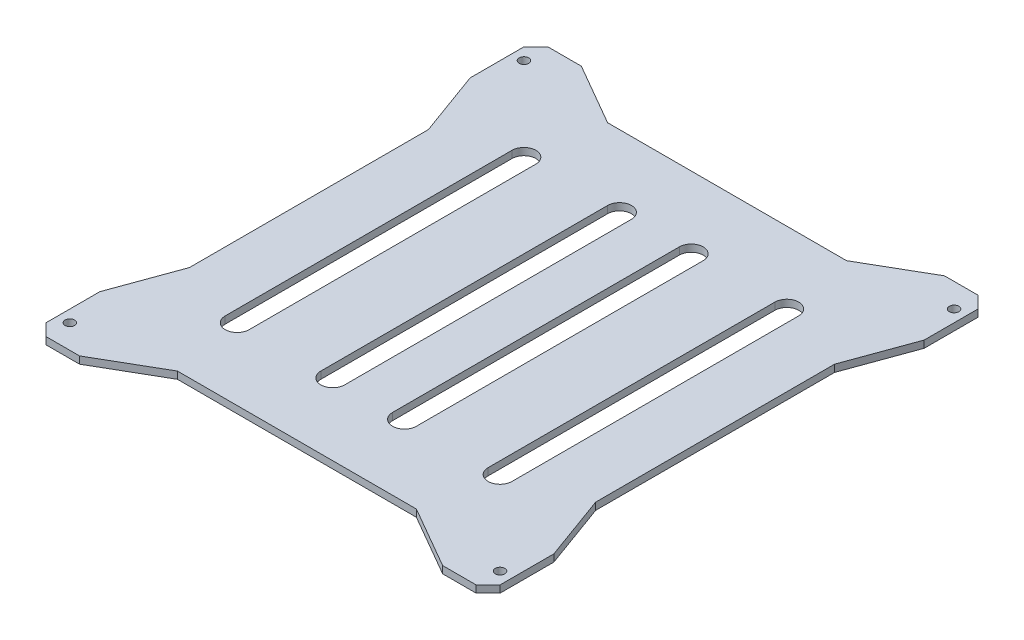
from build123d import *

# Parameters (mm, degrees)
SKETCH_2_W          = 190
SKETCH_2_H          = 210
SKETCH_2_R          = 2
EXTRUDE_1_DEPTH     = 3
CUT_EXTRUDE_1_DEPTH = 142.629799124
CHAMFER_1_SIZE      = 5


with BuildPart() as part:
    # 草图2 → 凸台-拉伸1 (new body)
    with BuildSketch(Plane(origin=(0, 0, 0), x_dir=(1, 0, 0), z_dir=(0, 1, 0))):
        Rectangle(SKETCH_2_W, SKETCH_2_H)
        with Locations(Location((-90, 95, 0), (0, 0, 270))):
            Circle(SKETCH_2_R, mode=Mode.SUBTRACT)
        with Locations(Location((90, 95, 0), (0, 0, 90))):
            Circle(SKETCH_2_R, mode=Mode.SUBTRACT)
        with Locations(Location((90, -95, 0), (0, 0, 270))):
            Circle(SKETCH_2_R, mode=Mode.SUBTRACT)
        with Locations(Location((-90, -95, 0), (0, 0, 90))):
            Circle(SKETCH_2_R, mode=Mode.SUBTRACT)
    extrude(amount=EXTRUDE_1_DEPTH)

    # 草图3 → 切除-拉伸1 (cut, through all)
    with BuildSketch(Plane(origin=(0, 0, 0), x_dir=(1, 0, 0), z_dir=(0, 1, 0))):
        Polygon((-75.980762114, 105), (-50, 90), (50, 90), (75.980762114, 105), align=None)
        Polygon((-95, 77.474774195), (-85, 50), (-85, -50), (-95, -77.474774195), align=None)
        with BuildLine():
            Line((-50, 60), (-50, -60))
            ThreePointArc((-50, -60), (-55, -65), (-60, -60))
            Line((-60, -60), (-60, 60))
            ThreePointArc((-60, 60), (-55, 65), (-50, 60))
        make_face()
        with BuildLine():
            Line((-10, 60), (-10, -60))
            ThreePointArc((-10, -60), (-15, -65), (-20, -60))
            Line((-20, -60), (-20, 60))
            ThreePointArc((-20, 60), (-15, 65), (-10, 60))
        make_face()
        with BuildLine():
            Line((10, 60), (10, -60))
            ThreePointArc((10, -60), (15, -65), (20, -60))
            Line((20, -60), (20, 60))
            ThreePointArc((20, 60), (15, 65), (10, 60))
        make_face()
        with BuildLine():
            Line((50, 60), (50, -60))
            ThreePointArc((50, -60), (55, -65), (60, -60))
            Line((60, -60), (60, 60))
            ThreePointArc((60, 60), (55, 65), (50, 60))
        make_face()
        Polygon((85, 50), (85, -50), (95, -77.474774195), (95, 77.474774195), align=None)
        Polygon((75.980762114, -105), (50, -90), (-50, -90), (-75.980762114, -105), align=None)
    extrude(amount=CUT_EXTRUDE_1_DEPTH, mode=Mode.SUBTRACT)

    # 倒角1
    chamfer_1_edges = [part.edges().sort_by_distance(p)[0] for p in [
        (-95, 1.5, -105),
        (95, 1.5, -105),
        (95, 1.5, 105),
        (-95, 1.5, 105),
    ]]
    chamfer(chamfer_1_edges, length=CHAMFER_1_SIZE)


solid = part.part
